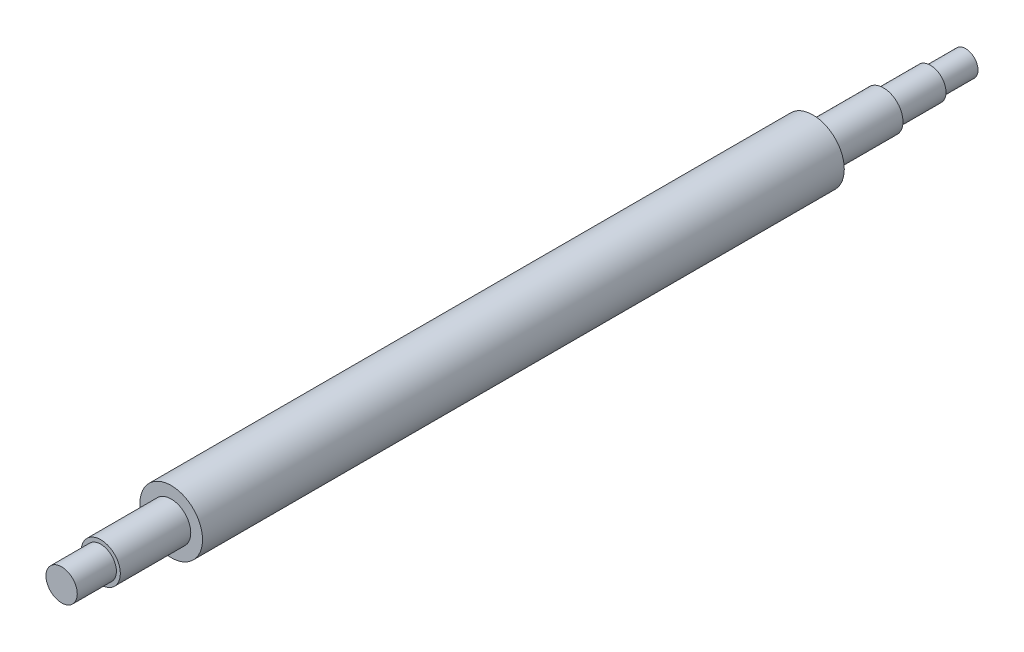
from build123d import *

# Parameters (mm, degrees)
SKETCH_1_R      = 8
EXTRUDE_1_DEPTH = 164
SKETCH_2_R      = 5
EXTRUDE_2_DEPTH = 18
SKETCH_4_R      = 5
EXTRUDE_3_DEPTH = 18
SKETCH_5_R      = 4
EXTRUDE_4_DEPTH = 10
SKETCH_9_R      = 4
EXTRUDE_5_DEPTH = 12
SKETCH_10_R     = 3.175
EXTRUDE_6_DEPTH = 9


with BuildPart() as part:
    # 草图1 → 凸台-拉伸1 (new body)
    with BuildSketch(Plane.XY):
        Circle(SKETCH_1_R)
    extrude(amount=EXTRUDE_1_DEPTH)


with BuildPart() as body_2:
    # 草图2 → 凸台-拉伸2 (new body)
    with BuildSketch(Plane.XY.offset(164)):
        Circle(SKETCH_2_R)
    extrude(amount=EXTRUDE_2_DEPTH)


with BuildPart() as body_3:
    # 草图4 → 凸台-拉伸3 (new body)
    with BuildSketch(Plane(origin=(0, 0, 0), x_dir=(-1, 0, 0), z_dir=(0, 0, -1))):
        Circle(SKETCH_4_R)
    extrude(amount=EXTRUDE_3_DEPTH)

    # 草图9 → 凸台-拉伸5 (add)
    with BuildSketch(Plane(origin=(0, 0, -18), x_dir=(-1, 0, 0), z_dir=(0, 0, -1))):
        with Locations(Location((0, 0, 0), (0, 0, 180))):
            Circle(SKETCH_9_R)
    extrude(amount=EXTRUDE_5_DEPTH)

    # 草图10 → 凸台-拉伸6 (add)
    with BuildSketch(Plane(origin=(0, 0, -30), x_dir=(-1, 0, 0), z_dir=(0, 0, -1))):
        Circle(SKETCH_10_R)
    extrude(amount=EXTRUDE_6_DEPTH)


with BuildPart() as body_4:
    # 草图5 → 凸台-拉伸4 (new body)
    with BuildSketch(Plane.XY.offset(182)):
        Circle(SKETCH_5_R)
    extrude(amount=EXTRUDE_4_DEPTH)


solid = Compound([part.part, body_2.part, body_3.part, body_4.part])
